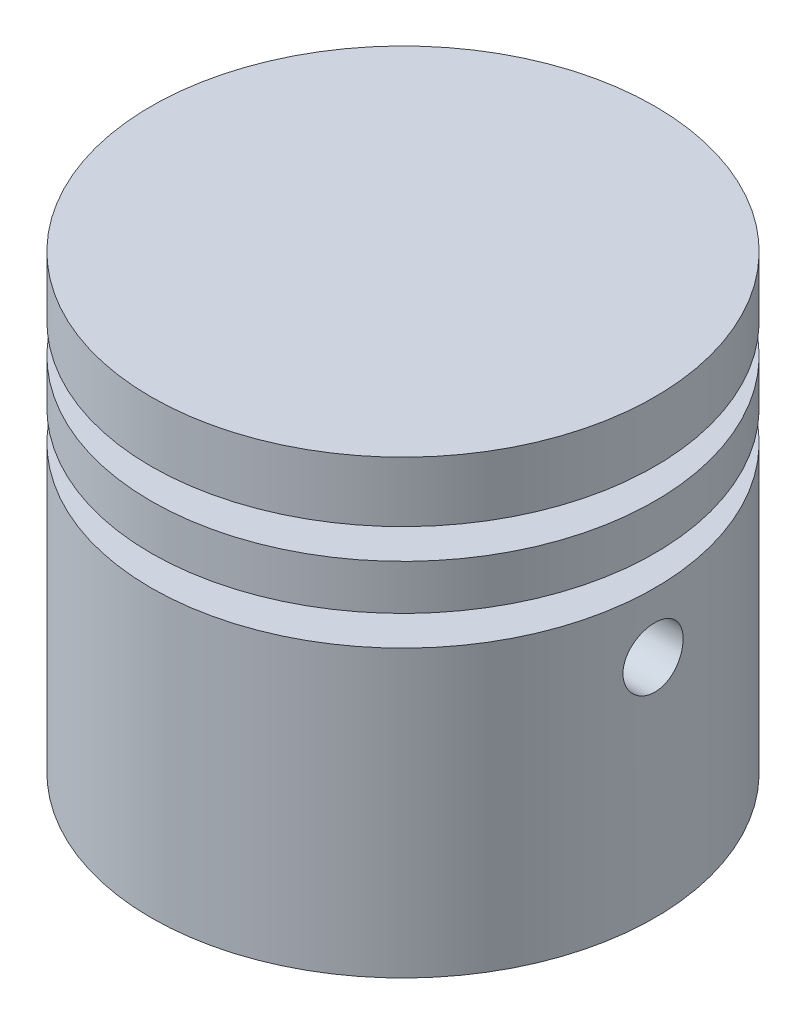
from build123d import *

# Parameters (mm, degrees)
CUT_EXTRUDE1_DEPTH      = 713.163187058
CUT_EXTRUDE1_DEPTH_BACK = 713.163187058
SKETCH4_R               = 50.8


with BuildPart() as part:
    # Sketch3 → Revolve1 (revolve)
    with BuildSketch(Plane.XY, mode=Mode.PRIVATE) as revolve1_sk:
        Polygon((0, 381), (0, 304.8), (-254, 304.8), (-254, -254), (-381, -381), (-425.45, -381), (-425.45, 101.6), (-336.55, 101.6), (-336.55, 152.4), (-425.45, 152.4), (-425.45, 228.6), (-336.55, 228.6), (-336.55, 279.4), (-425.45, 279.4), (-425.45, 381), align=None)
    revolve(revolve1_sk.sketch.rotate(Axis((0, -381, 0), (0, 1, 0)), 270), axis=Axis((0, -381, 0), (0, 1, 0)))

    # Sketch4 → Cut-Extrude1 (cut, two sides: drawn at the far end of the back side and taken through both)
    with BuildSketch(Plane(origin=(0, 0, 0), x_dir=(0, 0, -1), z_dir=(1, 0, 0)).offset(-CUT_EXTRUDE1_DEPTH_BACK)):
        Circle(SKETCH4_R)
    extrude(amount=CUT_EXTRUDE1_DEPTH + CUT_EXTRUDE1_DEPTH_BACK, mode=Mode.SUBTRACT)


solid = part.part
